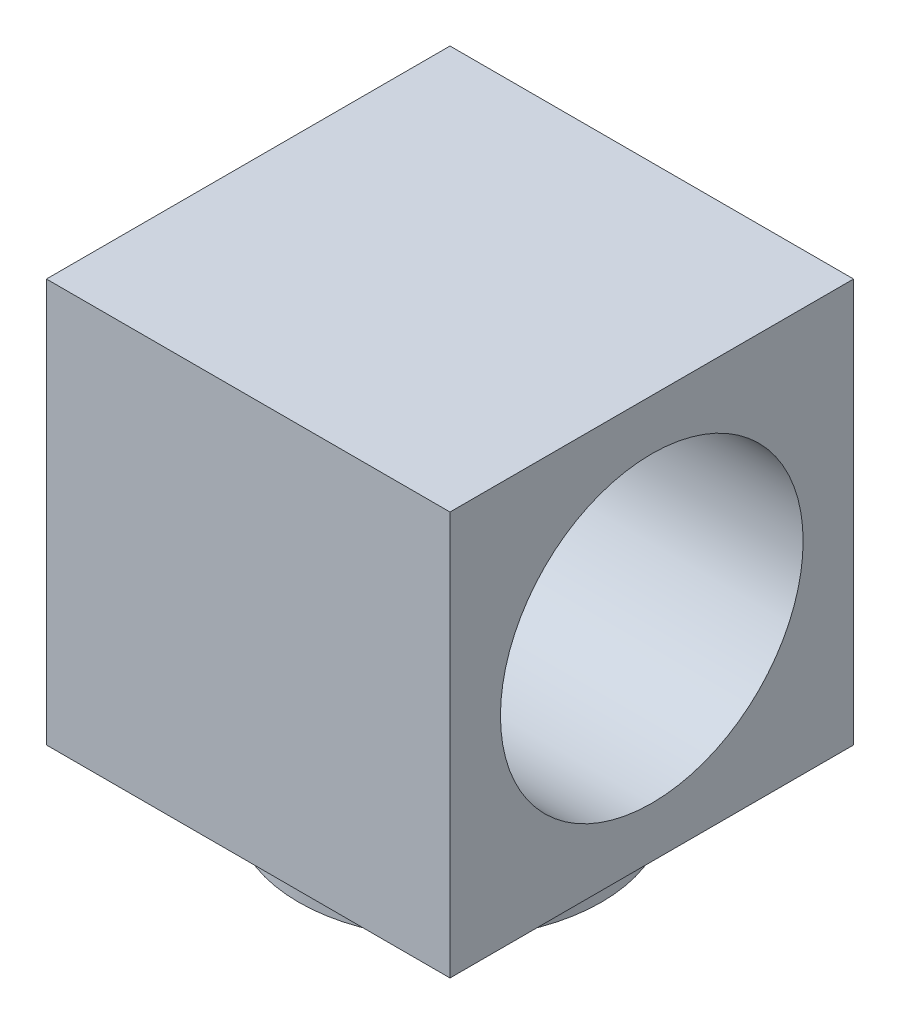
from build123d import *

# Parameters (mm, degrees)
SKETCH1_W           = 20
SKETCH1_H           = 20
BOSS_EXTRUDE1_DEPTH = 20
SKETCH2_R           = 7.5
CUT_EXTRUDE1_DEPTH  = 20
SKETCH3_R           = 7.5
SKETCH3_R_2         = 6.5
BOSS_EXTRUDE2_DEPTH = 3


with BuildPart() as part:
    # Sketch1 → Boss-Extrude1 (new body)
    with BuildSketch(Plane.XY):
        with Locations((10, 10)):
            Rectangle(SKETCH1_W, SKETCH1_H)
    extrude(amount=BOSS_EXTRUDE1_DEPTH)

    # Sketch2 → Cut-Extrude1 (cut)
    with BuildSketch(Plane(origin=(20, 0, 0), x_dir=(0, 0, -1), z_dir=(1, 0, 0))):
        with Locations((-10, 10)):
            Circle(SKETCH2_R)
    extrude(amount=-CUT_EXTRUDE1_DEPTH, mode=Mode.SUBTRACT)

    # Sketch3 → Boss-Extrude2 (add)
    with BuildSketch(Plane(origin=(0, 0, 0), x_dir=(-1, 0, 0), z_dir=(0, -1, 0))):
        with Locations(Location((-10, -10, 0), (0, 0, 270))):
            Circle(SKETCH3_R)
        with Locations(Location((-10, -10, 0), (0, 0, 90))):
            Circle(SKETCH3_R_2, mode=Mode.SUBTRACT)
    extrude(amount=BOSS_EXTRUDE2_DEPTH)


solid = part.part
